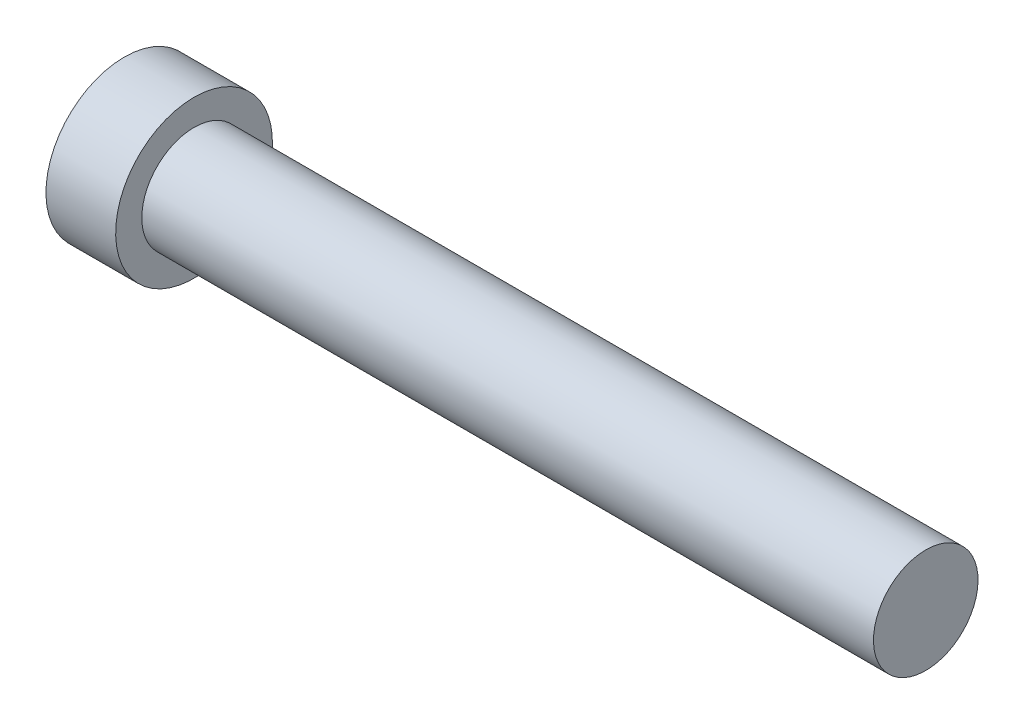
from build123d import *


with BuildPart() as part:
    # Sketch1 → Revolve1 (revolve)
    with BuildSketch(Plane.XY):
        Polygon((0, 0), (0, 22.5), (20, 22.5), (20, 15), (230, 15), (230, 0), align=None)
    revolve(axis=Axis((230, 0, 0), (-1, 0, 0)))


solid = part.part
